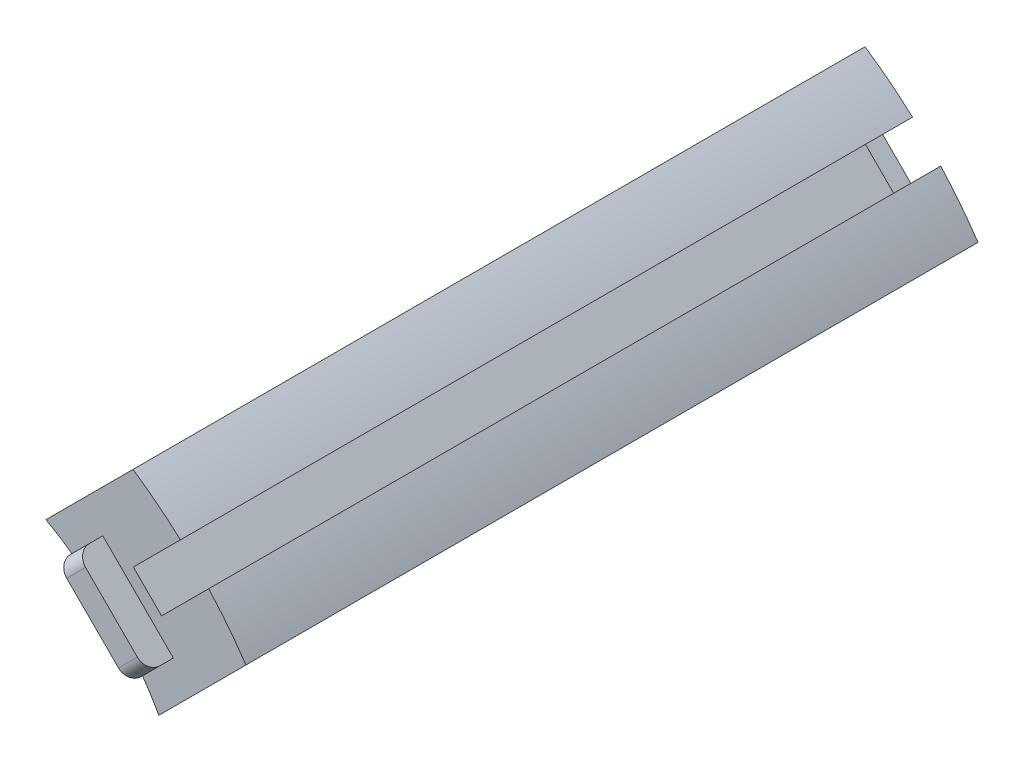
from build123d import *

# Parameters (mm, degrees)
BOSS_EXTRUDE1_DEPTH      = 110
SKETCH2_R                = 3
CUT_EXTRUDE1_DEPTH       = 55
BOSS_EXTRUDE2_DEPTH      = 114
BOSS_EXTRUDE2_DEPTH_BACK = 4
FILLET1_R                = 2


with BuildPart() as part:
    # Sketch1 → Boss-Extrude1 (new body)
    with BuildSketch(Plane.XY):
        with BuildLine():
            ThreePointArc((41.937258351, 46.258124568), (38.471168757, 49.184002684), (34.802002476, 51.850790754))
            Line((34.802002476, 51.850790754), (21.730642096, 38.779430374))
            ThreePointArc((21.730642096, 38.779430374), (31.38159768, 31.459823211), (38.701204844, 21.808867626))
            Line((38.701204844, 21.808867626), (51.772565224, 34.880228006))
            ThreePointArc((51.772565224, 34.880228006), (49.105777153, 38.549394287), (46.179899038, 42.015483881))
            Line((46.179899038, 42.015483881), (39.099113563, 34.934698406))
            Line((39.099113563, 34.934698406), (34.856472876, 39.177339093))
            Line((34.856472876, 39.177339093), (41.937258351, 46.258124568))
        make_face()
    extrude(amount=BOSS_EXTRUDE1_DEPTH)

    # Sketch2 → Cut-Extrude1 (cut, symmetric)
    with BuildSketch(Plane(origin=(2.082207578, -2.082207578, 0), x_dir=(0, 0, 1), z_dir=(-0.7071067811865467, 0.7071067811865485, 0))):
        with Locations((85, 57.356681906)):
            Circle(SKETCH2_R)
        with Locations((55, 57.356681906)):
            Circle(SKETCH2_R)
        with Locations((25, 57.356681906)):
            Circle(SKETCH2_R)
    extrude(amount=CUT_EXTRUDE1_DEPTH, both=True, mode=Mode.SUBTRACT)

    # Sketch1<5> → Boss-Extrude2 (add, two sides: drawn at the far end of the back side and taken through both)
    with BuildSketch(Plane.XY.offset(-BOSS_EXTRUDE2_DEPTH_BACK)):
        Polygon((40.866880516, 30.338504328), (30.260278798, 40.945106046), (27.431851673, 38.116678921), (38.038453391, 27.510077204), align=None)
    extrude(amount=BOSS_EXTRUDE2_DEPTH + BOSS_EXTRUDE2_DEPTH_BACK)

    # Fillet1
    fillet1_edges = [part.edges().sort_by_distance(p)[0] for p in [
        (28.846065236, 39.530892484, 114),
        (39.452666954, 28.924290766, 114),
        (28.846065236, 39.530892484, -4),
        (39.452666954, 28.924290766, -4),
    ]]
    fillet(fillet1_edges, radius=FILLET1_R)


solid = part.part
